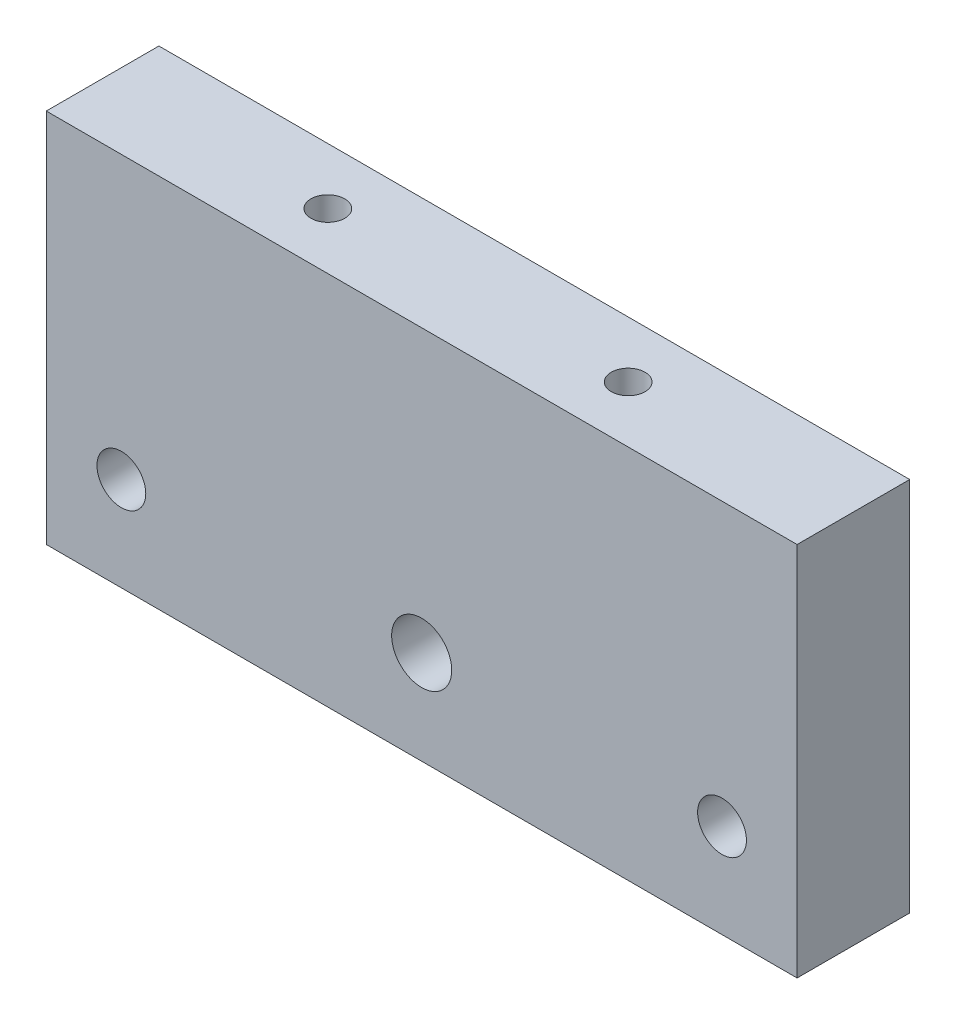
from build123d import *

# Parameters (mm, degrees)
SKETCH_1_W          = 200
SKETCH_1_H          = 100
EXTRUDE_1_DEPTH     = 30
SKETCH_2_R          = 4.5
SKETCH_2_R_2        = 8
CUT_EXTRUDE_1_DEPTH = 226.610283454
SKETCH_3_R          = 4.5
CUT_EXTRUDE_2_DEPTH = 226.610283454
SKETCH_4_R          = 6.5
CUT_EXTRUDE_3_DEPTH = 50
SKETCH_5_R          = 6.5
CUT_EXTRUDE_4_DEPTH = 15
SKETCH_6_R          = 12
CUT_EXTRUDE_5_DEPTH = 15


with BuildPart() as part:
    # 草图1 → 凸台-拉伸1 (new body)
    with BuildSketch(Plane.XY):
        with Locations((100, 50)):
            Rectangle(SKETCH_1_W, SKETCH_1_H)
    extrude(amount=EXTRUDE_1_DEPTH)

    # 草图2 → 切除-拉伸1 (cut, through all)
    with BuildSketch(Plane.XY.offset(30)):
        with Locations((20, 25)):
            Circle(SKETCH_2_R)
        with Locations((100, 25)):
            Circle(SKETCH_2_R_2)
        with Locations((180, 25)):
            Circle(SKETCH_2_R)
    extrude(amount=-CUT_EXTRUDE_1_DEPTH, mode=Mode.SUBTRACT)

    # 草图3 → 切除-拉伸2 (cut, through all)
    with BuildSketch(Plane.XZ):
        with Locations(Location((60, 15, 0), (0, 0, 270))):
            Circle(SKETCH_3_R)
        with Locations(Location((140, 15, 0), (0, 0, 270))):
            Circle(SKETCH_3_R)
    extrude(amount=-CUT_EXTRUDE_2_DEPTH, mode=Mode.SUBTRACT)

    # 草图4 → 切除-拉伸3 (cut)
    with BuildSketch(Plane.XZ):
        with Locations(Location((60, 15, 0), (0, 0, 270))):
            Circle(SKETCH_4_R)
        with Locations(Location((140, 15, 0), (0, 0, 270))):
            Circle(SKETCH_4_R)
    extrude(amount=-CUT_EXTRUDE_3_DEPTH, mode=Mode.SUBTRACT)

    # 草图5 → 切除-拉伸4 (cut)
    with BuildSketch(Plane.XY.offset(30)):
        with Locations((20, 25)):
            Circle(SKETCH_5_R)
        with Locations((180, 25)):
            Circle(SKETCH_5_R)
    extrude(amount=-CUT_EXTRUDE_4_DEPTH, mode=Mode.SUBTRACT)

    # 草图6 → 切除-拉伸5 (cut)
    with BuildSketch(Plane(origin=(0, 0, 0), x_dir=(-1, 0, 0), z_dir=(0, 0, -1))):
        with Locations((-100, 25)):
            Circle(SKETCH_6_R)
    extrude(amount=-CUT_EXTRUDE_5_DEPTH, mode=Mode.SUBTRACT)


solid = part.part
